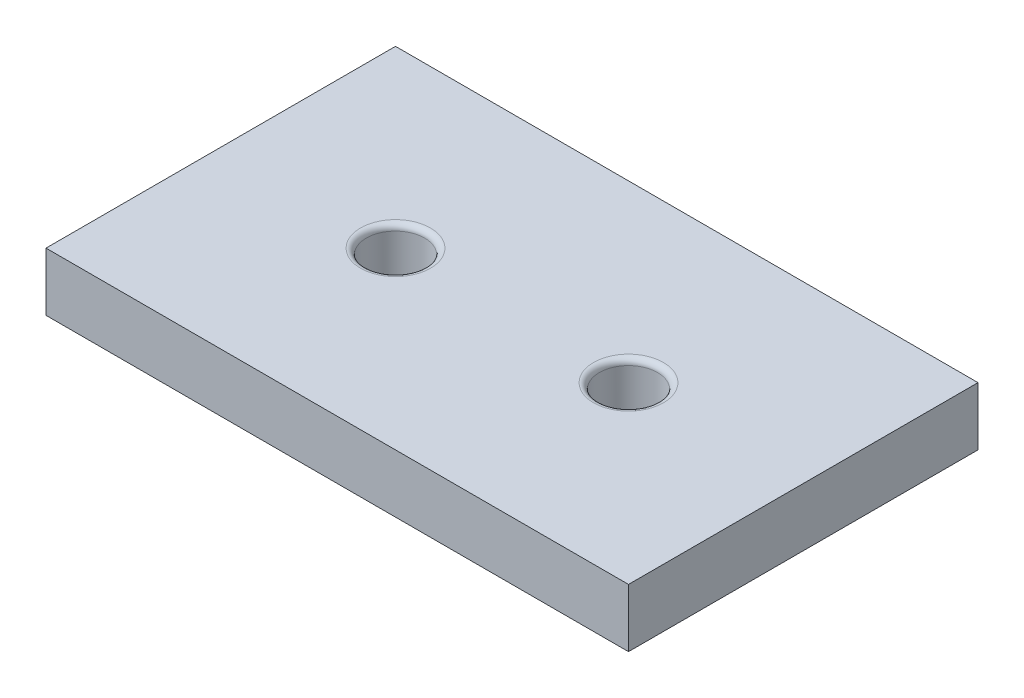
from build123d import *

# Parameters (mm, degrees)
SKETCH_1_W          = 100
SKETCH_1_H          = 60
EXTRUDE_1_DEPTH     = 10
SKETCH_2_R          = 5
CUT_EXTRUDE_1_DEPTH = 20
SKETCH_3_R          = 5
CUT_EXTRUDE_2_DEPTH = 20
FILLET_1_R          = 1


with BuildPart() as part:
    # 草图1 → 凸台-拉伸1 (new body)
    with BuildSketch(Plane(origin=(0, 0, 0), x_dir=(1, 0, 0), z_dir=(0, 1, 0))):
        Rectangle(SKETCH_1_W, SKETCH_1_H)
    extrude(amount=EXTRUDE_1_DEPTH)

    # 草图2 → 切除-拉伸1 (cut)
    with BuildSketch(Plane(origin=(0, 0, 0), x_dir=(1, 0, 0), z_dir=(0, 1, 0))):
        with Locations(Location((-20, 0, 0), (0, 0, 90))):
            Circle(SKETCH_2_R)
    extrude(amount=CUT_EXTRUDE_1_DEPTH, mode=Mode.SUBTRACT)

    # 草图3 → 切除-拉伸2 (cut)
    with BuildSketch(Plane(origin=(0, 0, 0), x_dir=(1, 0, 0), z_dir=(0, 1, 0))):
        with Locations(Location((20, 0, 0), (0, 0, 90))):
            Circle(SKETCH_3_R)
    extrude(amount=CUT_EXTRUDE_2_DEPTH, mode=Mode.SUBTRACT)

    # 圆角1
    fillet_1_edges = [part.edges().sort_by_distance(p)[0] for p in [
        (-20, 10, 5),
        (20, 10, 5),
    ]]
    fillet(fillet_1_edges, radius=FILLET_1_R)


solid = part.part
